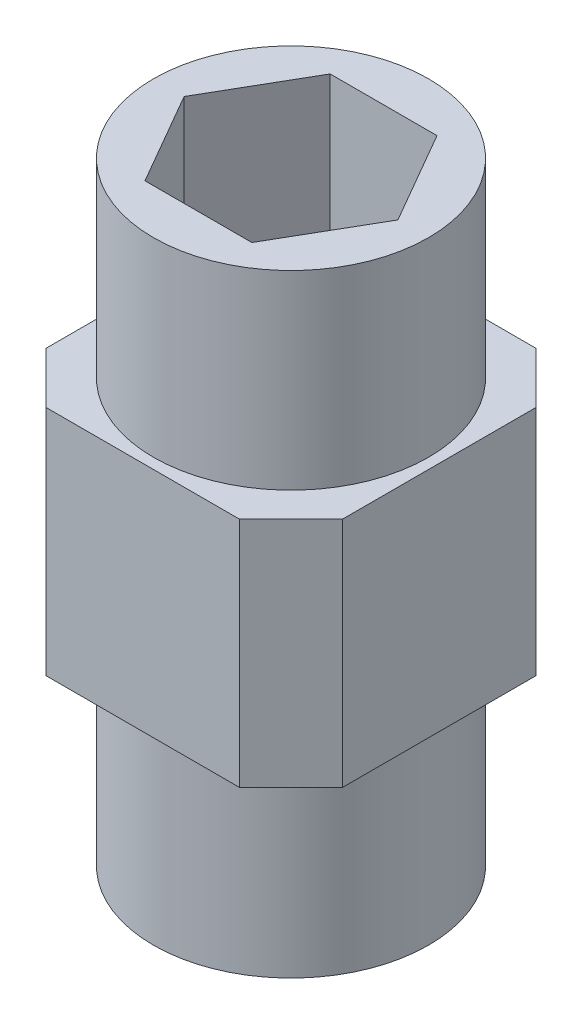
from build123d import *

# Parameters (mm, degrees)
SKETCH1_R           = 9.475
BOSS_EXTRUDE1_DEPTH = 13.1
BOSS_EXTRUDE3_DEPTH = 16


with BuildPart() as part:
    # Sketch1 → Boss-Extrude1 (new body)
    with BuildSketch(Plane(origin=(0, 0, 0), x_dir=(1, 0, 0), z_dir=(0, 1, 0))):
        with Locations(Location((0, 0, 0), (0, 0, 270))):
            Circle(SKETCH1_R)
        Polygon((7.361215932, 0), (3.680607966, 6.375), (-3.680607966, 6.375), (-7.361215932, 0), (-3.680607966, -6.375), (3.680607966, -6.375), align=None, mode=Mode.SUBTRACT)
    boss_extrude1 = extrude(amount=BOSS_EXTRUDE1_DEPTH)

    # Sketch2 → Boss-Extrude3 (add)
    with BuildSketch(Plane(origin=(0, 0, 0), x_dir=(1, 0, 0), z_dir=(0, 1, 0))):
        Polygon((-10.2, 6.664466094), (-6.664466094, 10.2), (6.664466094, 10.2), (10.2, 6.664466094), (10.2, -6.664466094), (6.664466094, -10.2), (-6.664466094, -10.2), (-10.2, -6.664466094), align=None)
        Polygon((3.680607966, 6.375), (-3.680607966, 6.375), (-7.361215932, 0), (-3.680607966, -6.375), (3.680607966, -6.375), (7.361215932, 0), align=None, mode=Mode.SUBTRACT)
    extrude(amount=-BOSS_EXTRUDE3_DEPTH)

    # Mirror1: Boss-Extrude1 across plane
    add(boss_extrude1.mirror(Plane.ZX.offset(-8)))


solid = part.part
